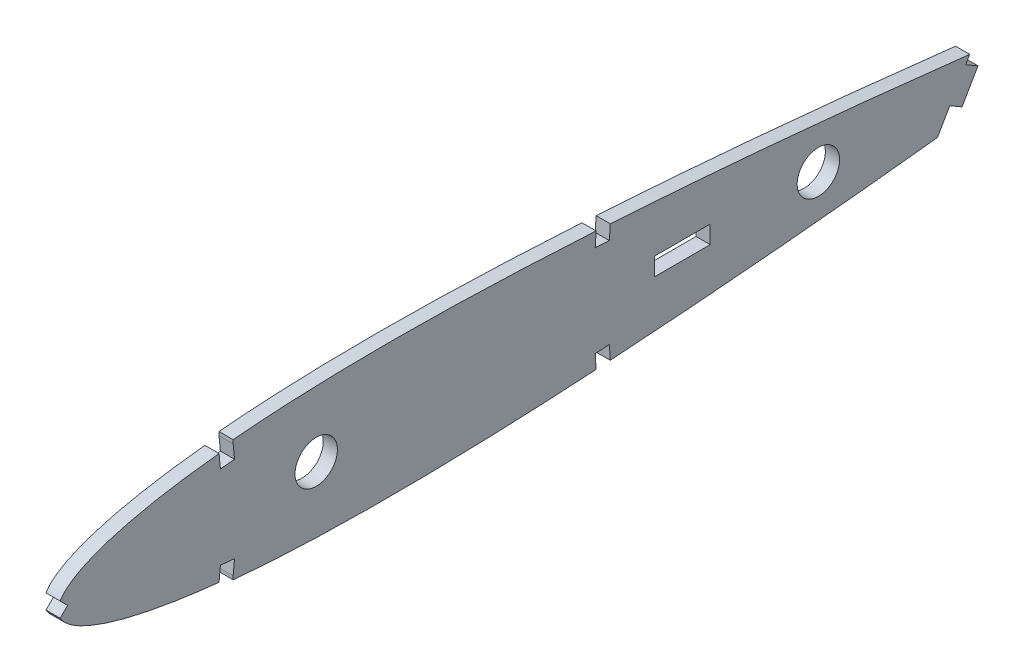
from build123d import *

# Parameters (mm, degrees)
MAIN_AIRFOIL_DEPTH               = 3.175
SPAR_HOLES_D                     = 9.5
LEADING_EDGE_SHEETING_DEPTH      = 251.46982022
LEADING_EDGE_SHEETING_DEPTH_BACK = 251.46982022
ENDPLATE_ELEVATOR_CUT_DEPTH      = 251.46982022
ENDPLATE_ELEVATOR_CUT_DEPTH_BACK = 251.46982022
STRINGERS_CUT_DEPTH              = 210.033152603
STRINGERS_CUT_DEPTH_BACK         = 210.033152603
SKETCH10_W                       = 12.5
SKETCH10_H                       = 4
CUT_EXTRUDE1_DEPTH               = 208.449962378


with BuildPart() as part:
    # Sketch1 → main airfoil (new body)
    with BuildSketch(Plane(origin=(0, 0, 0), x_dir=(0, 0, -1), z_dir=(1, 0, 0))):
        with BuildLine():
            add(Edge.make_bspline(
                [(250, -2e-09), (250, 0.018678284), (249.174689323, 0.093287857), (248.32446246, 0.259458763), (246.243044417, 0.533840137), (243.659362537, 0.910573958), (240.240612473, 1.384241178), (236.150430611, 1.945886269), (231.361161707, 2.586906774), (225.920856641, 3.297863303), (219.856797124, 4.06796415), (213.208366153, 4.885916807), (206.016018791, 5.741913973), (198.324180408, 6.62406412), (190.180187635, 7.520784501), (181.634404857, 8.421582341), (172.739445771, 9.314517476), (163.550215709, 10.187513224), (154.123274492, 11.028891603), (144.516832181, 11.82466947), (134.789982601, 12.562946799), (125.002727118, 13.229618159), (115.215358592, 13.810721438), (105.48818759, 14.29294213), (95.881251181, 14.663216165), (86.453504035, 14.909617829), (77.263215674, 15.020341748), (68.366854268, 14.987626073), (59.81926941, 14.804121641), (51.673066268, 14.465801182), (43.978409925, 13.97145626), (36.782541712, 13.323205499), (30.129564021, 12.525445662), (24.059974529, 11.585520991), (18.610573434, 10.513116535), (13.813297521, 9.320389204), (9.695407656, 8.018962504), (6.277825273, 6.620958993), (3.57144917, 5.13583648), (1.580443808, 3.560663864), (0.305221072, 1.857334126), (-0.142243872, 0), (0.305221072, -1.857334126), (1.580443808, -3.560663864), (3.57144917, -5.13583648), (6.277825273, -6.620958993), (9.695407656, -8.018962504), (13.813297521, -9.320389204), (18.610573434, -10.513116535), (24.059974528, -11.585520991), (30.129564021, -12.525445662), (36.782541712, -13.3232055), (43.978409924, -13.97145626), (51.673066268, -14.465801183), (59.81926941, -14.804121642), (68.366854268, -14.987626074), (77.263215673, -15.020341748), (86.453504035, -14.90961783), (95.881251181, -14.663216166), (105.48818759, -14.292942132), (115.215358592, -13.810721439), (125.002727117, -13.229618161), (134.789982601, -12.562946801), (144.516832181, -11.824669472), (154.123274492, -11.028891605), (163.550215709, -10.187513226), (172.73944577, -9.314517478), (181.634404857, -8.421582343), (190.180187634, -7.520784503), (198.324180408, -6.624064123), (206.016018791, -5.741913976), (213.208366153, -4.88591681), (219.856797124, -4.067964152), (225.920856641, -3.297863306), (231.361161707, -2.586906777), (236.150430611, -1.945886272), (240.240612473, -1.384241181), (243.659362537, -0.910573961), (246.243044417, -0.53384014), (248.32446246, -0.259458766), (249.174689323, -0.09328786), (250, -0.018678287), (250, -2e-09)],
                knots=[0, 0, 0, 0, 0.000763607, 0.003050195, 0.006844435, 0.012122612, 0.018850497, 0.026986066, 0.036476947, 0.047263893, 0.059278171, 0.072445234, 0.086681978, 0.101899794, 0.118004328, 0.134894608, 0.152465716, 0.170609402, 0.189211673, 0.208158561, 0.227331554, 0.24661328, 0.265884303, 0.285025762, 0.303921916, 0.322456848, 0.340520504, 0.358003941, 0.374805255, 0.390827224, 0.405977835, 0.420173298, 0.433337329, 0.445401027, 0.456307113, 0.466008503, 0.474475471, 0.481698721, 0.48770537, 0.492584414, 0.496544073, 0.5, 0.503455927, 0.507415586, 0.51229463, 0.518301279, 0.525524529, 0.533991497, 0.543692887, 0.554598973, 0.566662671, 0.579826702, 0.594022165, 0.609172776, 0.625194745, 0.641996059, 0.659479496, 0.677543152, 0.696078084, 0.714974238, 0.734115697, 0.75338672, 0.772668446, 0.791841439, 0.810788327, 0.829390598, 0.847534284, 0.865105392, 0.881995672, 0.898100206, 0.913318022, 0.927554766, 0.940721829, 0.952736107, 0.963523053, 0.973013934, 0.981149503, 0.987877388, 0.993155565, 0.996949805, 0.999236393, 1, 1, 1, 1], degree=3))
        make_face()
    extrude(amount=MAIN_AIRFOIL_DEPTH)

    # spar holes (through all)
    with Locations(Plane(origin=(0, 0, 0), x_dir=(0, 0, -1), z_dir=(-1, 0, 0))):
        with Locations((58.61, 0), (171.11, 0)):
            Hole(SPAR_HOLES_D / 2)

    # Sketch6 → leading edge sheeting (cut, two sides: drawn at the far end of the back side and taken through both)
    with BuildSketch(Plane(origin=(0, 0, 0), x_dir=(0, 0, -1), z_dir=(1, 0, 0)).offset(-LEADING_EDGE_SHEETING_DEPTH_BACK)):
        with BuildLine():
            Line((40, 12.807365381), (40, 13.604416608))
            add(Edge.make_bspline(
                [(40, 13.604416608), (38.869847951, 13.500847876), (35.513913522, 13.171084048), (30.129564021, 12.525445662), (24.059974529, 11.585520991), (18.610573434, 10.513116535), (13.813297521, 9.320389204), (9.695407656, 8.018962504), (6.277825273, 6.620958993), (3.57144917, 5.13583648), (1.580443808, 3.560663864), (0.305221072, 1.857334126), (-0.142243872, 0), (0.305221072, -1.857334126), (1.580443808, -3.560663864), (3.57144917, -5.13583648), (6.277825273, -6.620958993), (9.695407656, -8.018962504), (13.813297521, -9.320389204), (18.610573434, -10.513116535), (24.059974528, -11.585520991), (30.129564021, -12.525445662), (35.513913522, -13.171084049), (38.869847951, -13.500847877), (40, -13.604416608)],
                knots=[0.413495277, 0.413495277, 0.413495277, 0.413495277, 0.420173298, 0.433337329, 0.445401027, 0.456307113, 0.466008503, 0.474475471, 0.481698721, 0.48770537, 0.492584414, 0.496544073, 0.5, 0.503455927, 0.507415586, 0.51229463, 0.518301279, 0.525524529, 0.533991497, 0.543692887, 0.554598973, 0.566662671, 0.579826702, 0.586504723, 0.586504723, 0.586504723, 0.586504723], degree=3))
            Line((40, -13.604416608), (40, -12.807365381))
            add(Edge.make_bspline(
                [(40, 12.807365381), (38.40786292, 12.661038334), (34.224541259, 12.237300077), (27.474178442, 11.36178624), (21.0700979, 10.229369386), (16.012396643, 9.066260541), (12.270596889, 8.028138366), (8.616107298, 6.766392907), (5.702422511, 5.447875773), (3.566846062, 4.126408683), (2.148370065, 2.959587264), (1.069514661, 1.574379386), (0.655867669, 0), (1.069514662, -1.574379386), (2.148370065, -2.959587264), (3.566846062, -4.126408683), (5.702422511, -5.447875773), (8.616107298, -6.766392907), (12.270596889, -8.028138366), (16.012396643, -9.066260541), (21.0700979, -10.229369387), (27.474178442, -11.36178624), (34.224541259, -12.237300077), (38.40786292, -12.661038334), (40, -12.807365381)],
                knots=[0.413638355, 0.413638355, 0.413638355, 0.413638355, 0.423075232, 0.438460185, 0.453845139, 0.461537616, 0.469230093, 0.476922569, 0.484615046, 0.488461285, 0.492307523, 0.496153762, 0.5, 0.503846238, 0.507692477, 0.511538715, 0.515384954, 0.523077431, 0.530769907, 0.538462384, 0.546154861, 0.561539815, 0.576924768, 0.586361645, 0.586361645, 0.586361645, 0.586361645], degree=3))
        make_face()
    extrude(amount=LEADING_EDGE_SHEETING_DEPTH + LEADING_EDGE_SHEETING_DEPTH_BACK, mode=Mode.SUBTRACT)

    # Sketch5 → endplate elevator cut (cut, two sides: drawn at the far end of the back side and taken through both)
    with BuildSketch(Plane(origin=(0, 0, 0), x_dir=(0, 0, -1), z_dir=(1, 0, 0)).offset(-ENDPLATE_ELEVATOR_CUT_DEPTH_BACK)):
        Polygon((209.150369343, 6.626585949), (201.726255621, -6.232356218), (201.726255621, -23.257370884), (308.705498093, -23.257370884), (308.705498093, 11.775498724), (209.150369343, 11.775498724), align=None)
    extrude(amount=ENDPLATE_ELEVATOR_CUT_DEPTH + ENDPLATE_ELEVATOR_CUT_DEPTH_BACK, mode=Mode.SUBTRACT)

    # Sketch7 → stringers cut (cut, two sides: drawn at the far end of the back side and taken through both)
    with BuildSketch(Plane(origin=(0, 0, 0), x_dir=(0, 0, -1), z_dir=(1, 0, 0)).offset(-STRINGERS_CUT_DEPTH_BACK)):
        Polygon((2.907690166, 0), (0.662626136, 2.24506403), (-1.582437894, 0), (0.662626136, -2.24506403), align=None)
        Polygon((40.310657599, 9.647600064), (39.689342401, 15.967130698), (36.529577084, 15.656473098), (37.150892283, 9.336942465), align=None)
        Polygon((37.150892283, -9.336942466), (36.529577084, -15.656473099), (39.689342401, -15.967130698), (40.310657599, -9.647600065), align=None)
        Polygon((121.517319842, 16.612805303), (121.125349101, 10.27491457), (124.294294467, 10.0789292), (124.686265208, 16.416819933), align=None)
        Polygon((207.307838534, 9.785228973), (204.132838534, 4.285967659), (206.882469191, 2.698467659), (210.057469191, 8.197728973), align=None)
        Polygon((200.564124964, -1.895225561), (197.389124964, -7.394486875), (200.138755621, -8.981986875), (203.313755621, -3.482725561), align=None)
        Polygon((121.125349101, -10.274914572), (121.517319841, -16.612805305), (124.686265208, -16.416819934), (124.294294467, -10.078929202), align=None)
    extrude(amount=STRINGERS_CUT_DEPTH + STRINGERS_CUT_DEPTH_BACK, mode=Mode.SUBTRACT)

    # Sketch10 → Cut-Extrude1 (cut, through all)
    with BuildSketch(Plane(origin=(3.175, 0, 0), x_dir=(0, 0, -1), z_dir=(1, 0, 0))):
        with Locations((140.632469191, 0)):
            Rectangle(SKETCH10_W, SKETCH10_H)
    extrude(amount=-CUT_EXTRUDE1_DEPTH, mode=Mode.SUBTRACT)


solid = part.part
